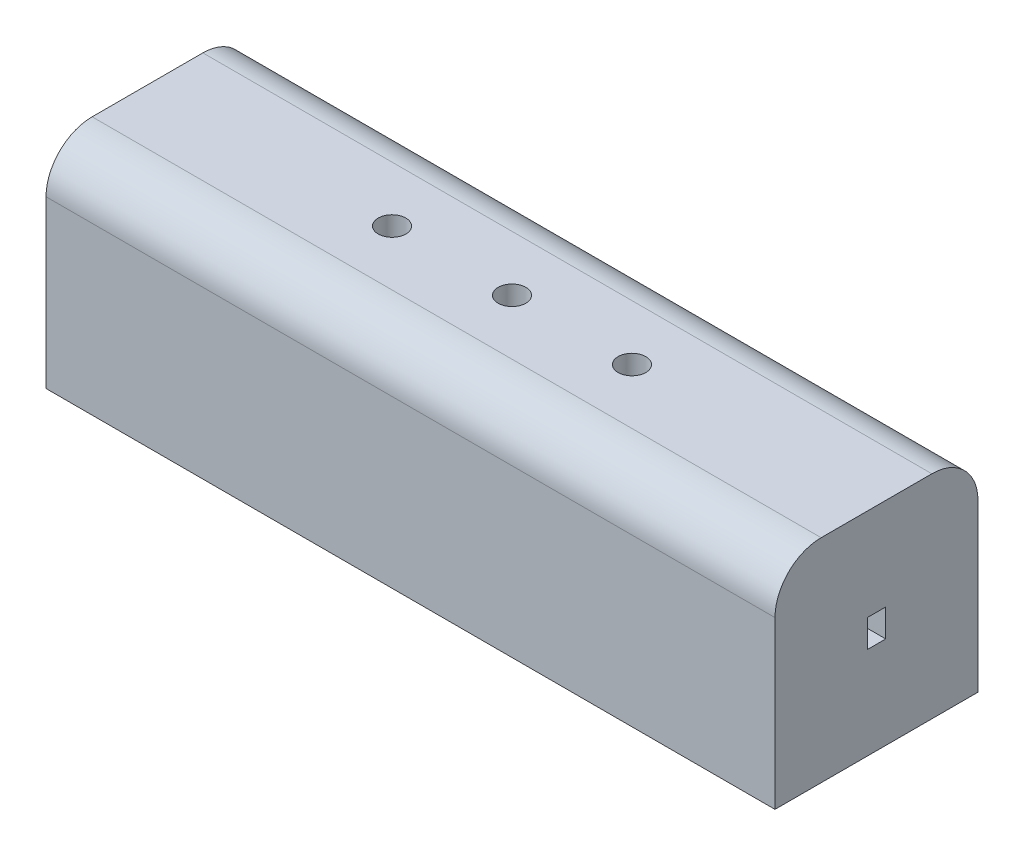
from build123d import *

# Parameters (mm, degrees)
EXTRUS_O_FINA1_DEPTH       = 39.5
EXTRUS_O_FINA1_DEPTH_BACK  = 39.5
CORTE_EXTRUS_O3_DEPTH      = 48.013295992
CORTE_EXTRUS_O3_DEPTH_BACK = 48.013295992
ESBO_O1_R                  = 1.5


with BuildPart() as part:
    # Esboço2 → Extrusão-Fina1 (new, two sides: drawn at the far end of the back side and taken through both)
    with BuildSketch(Plane(origin=(0, 0, 0), x_dir=(0, 0, -1), z_dir=(1, 0, 0)).offset(-EXTRUS_O_FINA1_DEPTH_BACK)):
        with BuildLine():
            Line((6, 23), (0, 23))
            Line((0, 23), (-6, 23))
            ThreePointArc((-6, 23), (-9.535533906, 21.535533906), (-11, 18))
            Line((-11, 18), (-11, 0))
            Line((-11, 0), (11, 0))
            Line((11, 0), (11, 18))
            ThreePointArc((11, 18), (9.535533906, 21.535533906), (6, 23))
        make_face()
        Polygon((1, 13), (0, 13), (-1, 13), (-1, 10), (1, 10), align=None, mode=Mode.SUBTRACT)
    extrude(amount=EXTRUS_O_FINA1_DEPTH + EXTRUS_O_FINA1_DEPTH_BACK)

    # Esboço1 → Corte-extrusão3 (cut, two sides: drawn at the far end of the back side and taken through both)
    with BuildSketch(Plane(origin=(0, 0, 0), x_dir=(1, 0, 0), z_dir=(0, 1, 0)).offset(-CORTE_EXTRUS_O3_DEPTH_BACK)):
        with Locations(Location((13, 0, 0), (0, 0, 270))):
            Circle(ESBO_O1_R)
        with Locations(Location((0, 0, 0), (0, 0, 270))):
            Circle(ESBO_O1_R)
        with Locations(Location((-13, 0, 0), (0, 0, 270))):
            Circle(ESBO_O1_R)
    extrude(amount=CORTE_EXTRUS_O3_DEPTH + CORTE_EXTRUS_O3_DEPTH_BACK, mode=Mode.SUBTRACT)


solid = part.part
